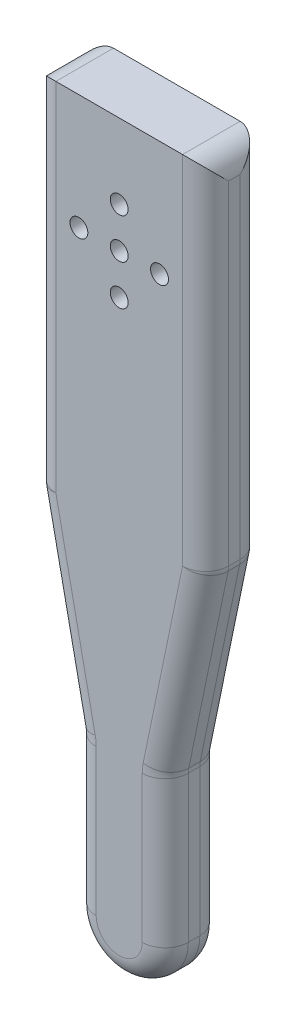
from build123d import *

# Parameters (mm, degrees)
SKETCH2_W           = 30
SKETCH2_H           = 130
BOSS_EXTRUDE1_DEPTH = 10
CUT_EXTRUDE3_DEPTH  = 75.64013832
FILLET3_RADIUS      = 8
FILLET3_LENGTH      = 10
FILLET4_R           = 4
SKETCH3_R           = 1.55
CUT_EXTRUDE4_DEPTH  = 75.64013841


with BuildPart() as part:
    # Sketch2 → Boss-Extrude1 (new body)
    with BuildSketch(Plane.XY):
        with Locations((-14.802371542, -2.697628458)):
            Rectangle(SKETCH2_W, SKETCH2_H)
    extrude(amount=BOSS_EXTRUDE1_DEPTH)

    # Sketch6 → Cut-Extrude3 (cut, through all)
    with BuildSketch(Plane.XY.offset(10)):
        Polygon((-29.802371542, -67.697628458), (-22.802371542, -67.697628458), (-22.802371542, -33.848814229), (-29.802371542, 0), align=None)
        Polygon((0.197628458, -67.697628458), (-6.802371542, -67.697628458), (-6.802371542, -33.848814229), (0.197628458, 0), align=None)
    extrude(amount=-CUT_EXTRUDE3_DEPTH, mode=Mode.SUBTRACT)

    # Fillet3: full round fillet: the end face becomes a half cylinder, R = half its width
    fillet3_face = Plane((-14.802371542, -67.697628458, 5), x_dir=(0, 0, 1), z_dir=(0, -1, 0))  # on the end face: x along it, z out of the body
    fillet3_slab = fillet3_face.offset(-FILLET3_RADIUS / 2) * Box(FILLET3_LENGTH, 2 * FILLET3_RADIUS, FILLET3_RADIUS, mode=Mode.PRIVATE)  # the body's end, R deep
    fillet3_round = Plane((-14.802371542, -59.697628458, 5), x_dir=(0, -1, 0), z_dir=(0, 0, 1)) * Cylinder(FILLET3_RADIUS, FILLET3_LENGTH, mode=Mode.PRIVATE)  # its axis R under the face
    add(fillet3_slab - fillet3_round, mode=Mode.SUBTRACT)

    # Fillet4
    fillet4_edges = [part.edges().sort_by_distance(p)[0] for p in [
        (0.197628458, 31.151185771, 0),
        (0.197628458, 31.151185771, 10),
        (-3.302371542, -16.924407115, 10),
        (-6.802371542, -33.848814229, 5),
        (0.197628458, 0, 5),
        (-3.302371542, -16.924407115, 0),
        (-26.302371542, -16.924407115, 10),
        (-29.802371542, 0, 5),
        (-22.802371542, -33.848814229, 5),
        (-26.302371542, -16.924407115, 0),
        (-22.802371542, -46.773221344, 10),
        (-22.802371542, -46.773221344, 0),
        (-6.802371542, -46.773221344, 10),
        (-6.802371542, -46.773221344, 0),
        (-14.802371542, -67.697628458, 0),
        (-14.802371542, -67.697628458, 10),
        (-29.802371542, 31.151185771, 10),
        (-29.802371542, 31.151185771, 0),
        (-29.802371542, 62.302371542, 5),
        (0.197628458, 62.302371542, 5),
    ]]
    fillet(fillet4_edges, radius=FILLET4_R)

    # Sketch3 → Cut-Extrude4 (cut, through all)
    with BuildSketch(Plane.XY.offset(10)):
        with Locations((-21.802371542, 42.302371542)):
            Circle(SKETCH3_R)
        with Locations((-14.802371542, 49.302371542)):
            Circle(SKETCH3_R)
        with Locations((-7.802371542, 42.302371542)):
            Circle(SKETCH3_R)
        with Locations((-14.802371542, 35.302371542)):
            Circle(SKETCH3_R)
        with Locations((-14.802371542, 42.302371542)):
            Circle(SKETCH3_R)
    extrude(amount=-CUT_EXTRUDE4_DEPTH, mode=Mode.SUBTRACT)


solid = part.part
